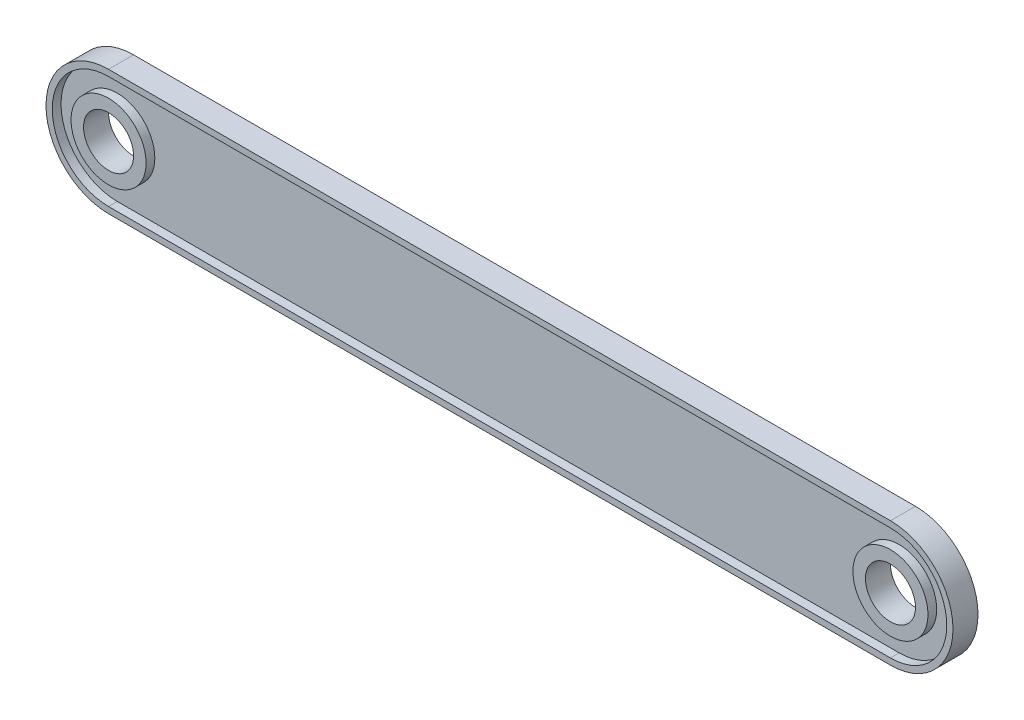
from build123d import *

# Parameters (mm, degrees)
SKETCH1_R          = 20
EXTRUDE1_DEPTH     = 10
SKETCH2_R          = 30
CUT_EXTRUDE1_DEPTH = 7


with BuildPart() as part:
    # Sketch1 → Extrude1 (new, symmetric)
    with BuildSketch(Plane.XY):
        with BuildLine():
            Line((0, 50), (-625, 50))
            ThreePointArc((-625, 50), (-675, 0), (-625, -50))
            Line((-625, -50), (0, -50))
            ThreePointArc((0, -50), (50, 0), (0, 50))
        make_face()
        Circle(SKETCH1_R, mode=Mode.SUBTRACT)
        with Locations((-625, 0)):
            Circle(SKETCH1_R, mode=Mode.SUBTRACT)
    extrude(amount=EXTRUDE1_DEPTH, both=True)

    # Sketch2 → Cut-Extrude1 (cut)
    with BuildSketch(Plane.XY.offset(10)):
        with BuildLine():
            Line((0, 45), (-625, 45))
            ThreePointArc((-625, 45), (-670, 0), (-625, -45))
            Line((-625, -45), (0, -45))
            ThreePointArc((0, -45), (45, 0), (0, 45))
        make_face()
        Circle(SKETCH2_R, mode=Mode.SUBTRACT)
        with Locations((-625, 0)):
            Circle(SKETCH2_R, mode=Mode.SUBTRACT)
    cut_extrude1 = extrude(amount=-CUT_EXTRUDE1_DEPTH, mode=Mode.SUBTRACT)

    # Mirror1: Cut-Extrude1 across plane
    add(cut_extrude1.mirror(Plane.XY), mode=Mode.SUBTRACT)


solid = part.part
